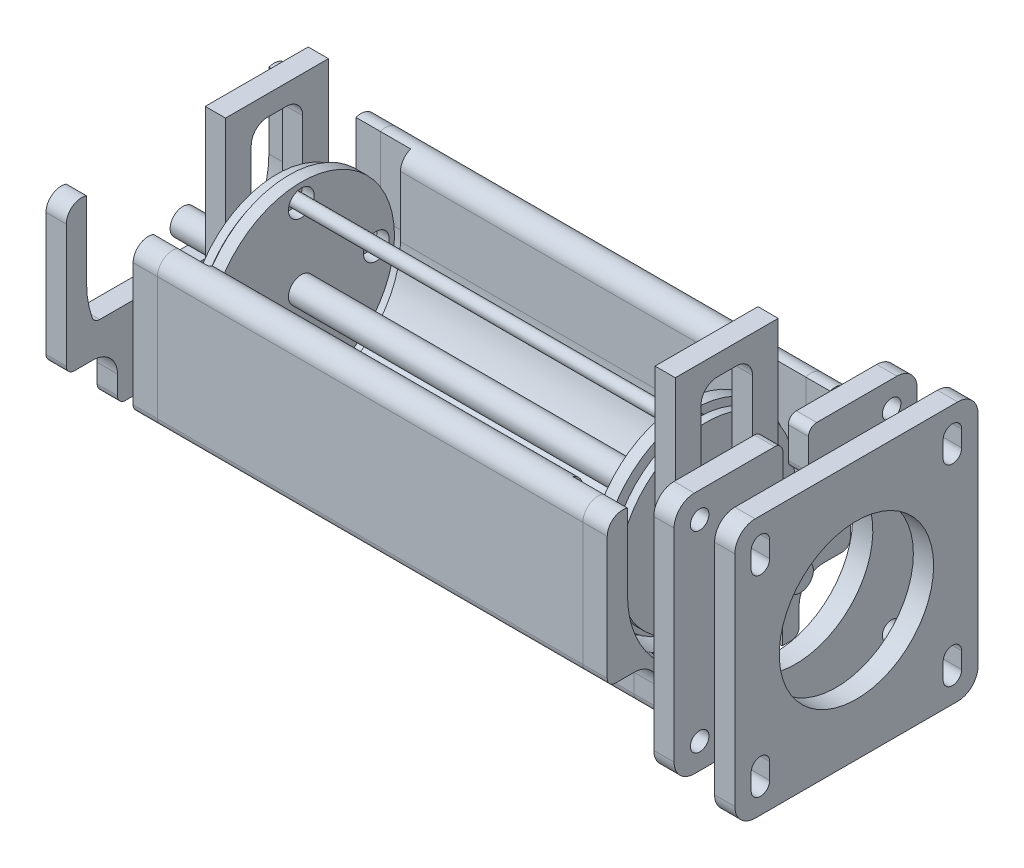
from build123d import *

# Parameters (mm, degrees)
SKETCH2_R                = 23
SKETCH2_R_2              = 3.175
BOSS_EXTRUDE2_DEPTH      = 3
BOSS_EXTRUDE3_DEPTH      = 90
FILLET1_R                = 2
SKETCH16_R               = 21.6875
SKETCH16_R_2             = 3.175
BOSS_EXTRUDE7_DEPTH      = 2
SKETCH21_R               = 1.5875
COMPRESSION_RODS_DEPTH   = 50.8
COMPRESSION_RODS_2_DEPTH = 50.8
COMPRESSION_RODS_3_DEPTH = 50.8
COMPRESSION_RODS_4_DEPTH = 50.8
BOSS_EXTRUDE13_DEPTH     = 7.5
FILLET4_R                = 2
SKETCH25_R               = 6.35
BOSS_EXTRUDE14_DEPTH     = 5
BOSS_EXTRUDE15_DEPTH     = 6
BOSS_EXTRUDE15_2_DEPTH   = 6
SKETCH27_R               = 2.286
BOSS_EXTRUDE17_DEPTH     = 5
FILLET7_R                = 2
FILLET8_R                = 2
SKETCH28_R               = 3.175
BOSS_EXTRUDE19_DEPTH     = 76.2
SKETCH30_R               = 19.05
BOSS_EXTRUDE21_DEPTH     = 5
BOSS_EXTRUDE22_DEPTH     = 5


with BuildPart() as part:
    # Sketch2 → Boss-Extrude2 (new body)
    with BuildSketch(Plane(origin=(-50, 0, 0), x_dir=(0, 0, -1), z_dir=(1, 0, 0))):
        Circle(SKETCH2_R)
        Circle(SKETCH2_R_2, mode=Mode.SUBTRACT)
        with Locations((0, 18.5125)):
            Circle(SKETCH2_R_2, mode=Mode.SUBTRACT)
        with Locations((-18.5125, 0)):
            Circle(SKETCH2_R_2, mode=Mode.SUBTRACT)
        with Locations((0, -18.5125)):
            Circle(SKETCH2_R_2, mode=Mode.SUBTRACT)
        with Locations((18.5125, 0)):
            Circle(SKETCH2_R_2, mode=Mode.SUBTRACT)
    extrude(amount=BOSS_EXTRUDE2_DEPTH)


with BuildPart() as body_2:
    # Sketch3 → Boss-Extrude3 (new body)
    with BuildSketch(Plane(origin=(45, 0, 0), x_dir=(0, 0, -1), z_dir=(1, 0, 0))):
        with BuildLine():
            Line((-22.48125, 0), (-22.48125, 15))
            ThreePointArc((-22.48125, 15), (-26.240625, 18.759375), (-30, 15))
            Line((-30, 15), (-30, -17.371))
            Line((-30, -17.371), (-23.371, -17.371))
            ThreePointArc((-23.371, -17.371), (-19.128359313, -19.128359313), (-17.371, -23.371))
            Line((-17.371, -23.371), (-17.371, -30))
            Line((-17.371, -30), (17.371, -30))
            Line((17.371, -30), (17.371, -23.371))
            ThreePointArc((17.371, -23.371), (19.128359313, -19.128359313), (23.371, -17.371))
            Line((23.371, -17.371), (30, -17.371))
            Line((30, -17.371), (30, 15))
            ThreePointArc((30, 15), (26.240625, 18.759375), (22.48125, 15))
            Line((22.48125, 15), (22.48125, 0))
            ThreePointArc((22.48125, 0), (0, -22.48125), (-22.48125, 0))
        make_face()
    extrude(amount=-BOSS_EXTRUDE3_DEPTH)

    # Fillet1
    fillet1_edges = [body_2.edges().sort_by_distance(p)[0] for p in [
        (0, -30, -17.371),
        (0, -30, 17.371),
        (0, -17.371, 30),
        (0, -17.371, -30),
    ]]
    fillet(fillet1_edges, radius=FILLET1_R)


with BuildPart() as body_3:
    # Sketch16 → Boss-Extrude7 (new body)
    with BuildSketch(Plane(origin=(-51, 0, 0), x_dir=(0, 0, -1), z_dir=(1, 0, 0))):
        Circle(SKETCH16_R)
        Circle(SKETCH16_R_2, mode=Mode.SUBTRACT)
    extrude(amount=-BOSS_EXTRUDE7_DEPTH)


with BuildPart() as body_4:
    # Sketch21 → Compression_Rods (new, symmetric)
    with BuildSketch(Plane(origin=(0, 0, 0), x_dir=(0, 0, -1), z_dir=(1, 0, 0))):
        with Locations((-18.5125, 0)):
            Circle(SKETCH21_R)
    extrude(amount=COMPRESSION_RODS_DEPTH, both=True)


with BuildPart() as body_5:
    # Sketch21 → Compression_Rods 2 (new, symmetric)
    with BuildSketch(Plane(origin=(0, 0, 0), x_dir=(0, 0, -1), z_dir=(1, 0, 0))):
        with Locations((0, 18.5125)):
            Circle(SKETCH21_R)
    extrude(amount=COMPRESSION_RODS_2_DEPTH, both=True)


with BuildPart() as body_6:
    # Sketch21 → Compression_Rods 3 (new, symmetric)
    with BuildSketch(Plane(origin=(0, 0, 0), x_dir=(0, 0, -1), z_dir=(1, 0, 0))):
        with Locations((18.5125, 0)):
            Circle(SKETCH21_R)
    extrude(amount=COMPRESSION_RODS_3_DEPTH, both=True)


with BuildPart() as body_7:
    # Sketch21 → Compression_Rods 4 (new, symmetric)
    with BuildSketch(Plane(origin=(0, 0, 0), x_dir=(0, 0, -1), z_dir=(1, 0, 0))):
        with Locations((0, -18.5125)):
            Circle(SKETCH21_R)
    extrude(amount=COMPRESSION_RODS_4_DEPTH, both=True)


with BuildPart() as body_8:
    # Mirror2: mirrored copy
    add(part.part.mirror(Plane(origin=(0, 0, 0), x_dir=(0, 0, 1), z_dir=(1, 0, 0))))


with BuildPart() as body_9:
    # Mirror2 2: mirrored copy
    add(body_3.part.mirror(Plane(origin=(0, 0, 0), x_dir=(0, 0, 1), z_dir=(1, 0, 0))))


with BuildPart() as body_10:
    # Sketch24 → Boss-Extrude13 (new body)
    with BuildSketch(Plane(origin=(45, 0, 0), x_dir=(0, 0, -1), z_dir=(1, 0, 0))):
        with BuildLine():
            Line((-25, 0), (-25, 18.548767392))
            ThreePointArc((-25, 18.548767392), (-28.416507095, 18.065687117), (-30, 15))
            Line((-30, 15), (-30, -17.371))
            Line((-30, -17.371), (-23.371, -17.371))
            ThreePointArc((-23.371, -17.371), (-19.128359313, -19.128359313), (-17.371, -23.371))
            Line((-17.371, -23.371), (-17.371, -30))
            Line((-17.371, -30), (17.371, -30))
            Line((17.371, -30), (17.371, -23.371))
            ThreePointArc((17.371, -23.371), (19.128359313, -19.128359313), (23.371, -17.371))
            Line((23.371, -17.371), (30, -17.371))
            Line((30, -17.371), (30, 15))
            ThreePointArc((30, 15), (28.416507095, 18.065687117), (25, 18.548767392))
            Line((25, 18.548767392), (25, 0))
            ThreePointArc((25, 0), (0, -25), (-25, 0))
        make_face()
    extrude(amount=BOSS_EXTRUDE13_DEPTH)

    # Fillet4
    fillet4_edges = [body_10.edges().sort_by_distance(p)[0] for p in [
        (48.75, -30, 17.371),
        (48.75, -17.371, 30),
        (48.75, -30, -17.371),
        (48.75, -17.371, -30),
    ]]
    fillet(fillet4_edges, radius=FILLET4_R)


with BuildPart() as body_11:
    # Sketch25 → Boss-Extrude14 (new body)
    with BuildSketch(Plane(origin=(53, 0, 0), x_dir=(0, 0, -1), z_dir=(1, 0, 0))):
        with BuildLine():
            ThreePointArc((-12.7, 0), (0, -12.7), (12.7, 0))
            Line((12.7, 0), (12.7, 40))
            Line((12.7, 40), (-12.7, 40))
            Line((-12.7, 40), (-12.7, 0))
        make_face()
        Circle(SKETCH25_R, mode=Mode.SUBTRACT)
        with BuildLine():
            Line((6.35, 31), (6.35, 12))
            ThreePointArc((6.35, 12), (5.178427125, 9.171572875), (2.35, 8))
            Line((2.35, 8), (-2.35, 8))
            ThreePointArc((-2.35, 8), (-5.178427125, 9.171572875), (-6.35, 12))
            Line((-6.35, 12), (-6.35, 31))
            ThreePointArc((-6.35, 31), (-5.178427125, 33.828427125), (-2.35, 35))
            Line((-2.35, 35), (2.35, 35))
            ThreePointArc((2.35, 35), (5.178427125, 33.828427125), (6.35, 31))
        make_face(mode=Mode.SUBTRACT)
    extrude(amount=BOSS_EXTRUDE14_DEPTH)


with BuildPart() as body_12:
    # Sketch26 → Boss-Extrude15 (new body)
    with BuildSketch(Plane(origin=(52.5, 0, 0), x_dir=(0, 0, -1), z_dir=(1, 0, 0))):
        with BuildLine():
            Line((-25, 0), (-25, 18.548767392))
            ThreePointArc((-25, 18.548767392), (-28.416507095, 18.065687117), (-30, 15))
            Line((-30, 15), (-30, -17.371))
            Line((-30, -17.371), (-23.371, -17.371))
            ThreePointArc((-23.371, -17.371), (-19.128359313, -19.128359313), (-17.371, -23.371))
            Line((-17.371, -23.371), (-17.371, -30))
            Line((-17.371, -30), (-13.2, -30))
            Line((-13.2, -30), (-13.2, -21.23110925))
            ThreePointArc((-13.2, -21.23110925), (-21.851773383, -12.144957801), (-25, 0))
        make_face()
    extrude(amount=BOSS_EXTRUDE15_DEPTH)

    # Fillet7
    fillet7_edges = [body_12.edges().sort_by_distance(p)[0] for p in [
        (55.5, -30, 17.371),
        (55.5, -17.371, 30),
    ]]
    fillet(fillet7_edges, radius=FILLET7_R)


with BuildPart() as body_13:
    # Sketch26 → Boss-Extrude15 2 (new body)
    with BuildSketch(Plane(origin=(52.5, 0, 0), x_dir=(0, 0, -1), z_dir=(1, 0, 0))):
        with BuildLine():
            Line((13.2, -30), (13.2, -21.23110925))
            ThreePointArc((13.2, -21.23110925), (21.851773383, -12.144957801), (25, 0))
            Line((25, 0), (25, 18.548767392))
            ThreePointArc((25, 18.548767392), (28.416507095, 18.065687117), (30, 15))
            Line((30, 15), (30, -17.371))
            Line((30, -17.371), (23.371, -17.371))
            ThreePointArc((23.371, -17.371), (19.128359313, -19.128359313), (17.371, -23.371))
            Line((17.371, -23.371), (17.371, -30))
            Line((17.371, -30), (13.2, -30))
        make_face()
    extrude(amount=BOSS_EXTRUDE15_2_DEPTH)

    # Fillet8
    fillet8_edges = [body_13.edges().sort_by_distance(p)[0] for p in [
        (55.5, -30, -17.371),
        (55.5, -17.371, -30),
    ]]
    fillet(fillet8_edges, radius=FILLET8_R)


with BuildPart() as body_14:
    # Sketch27 → Boss-Extrude17 (new body)
    with BuildSketch(Plane(origin=(70, 0, 0), x_dir=(0, 0, -1), z_dir=(1, 0, 0))):
        with BuildLine():
            Line((-5.175, 30), (-25, 30))
            ThreePointArc((-25, 30), (-28.535533906, 28.535533906), (-30, 25))
            Line((-30, 25), (-30, -25))
            ThreePointArc((-30, -25), (-28.535533906, -28.535533906), (-25, -30))
            Line((-25, -30), (25, -30))
            ThreePointArc((25, -30), (28.535533906, -28.535533906), (30, -25))
            Line((30, -25), (30, 25))
            ThreePointArc((30, 25), (28.535533906, 28.535533906), (25, 30))
            Line((25, 30), (5.175, 30))
            ThreePointArc((5.175, 30), (3.760786438, 29.414213562), (3.175, 28))
            Line((3.175, 28), (3.175, 20.403967139))
            ThreePointArc((3.175, 20.403967139), (3.596492331, 19.175832969), (4.683313539, 18.465347933))
            ThreePointArc((4.683313539, 18.465347933), (15.035285546, 11.697977968), (19.05, 0))
            ThreePointArc((19.05, 0), (0, -19.05), (-19.05, 0))
            ThreePointArc((-19.05, 0), (-15.035285546, 11.697977968), (-4.683313539, 18.465347933))
            ThreePointArc((-4.683313539, 18.465347933), (-3.596492331, 19.175832969), (-3.175, 20.403967139))
            Line((-3.175, 20.403967139), (-3.175, 28))
            ThreePointArc((-3.175, 28), (-3.760786438, 29.414213562), (-5.175, 30))
        make_face()
        with Locations((-23.6855, 23.6855)):
            Circle(SKETCH27_R, mode=Mode.SUBTRACT)
        with Locations((23.6855, 23.6855)):
            Circle(SKETCH27_R, mode=Mode.SUBTRACT)
        with Locations((-23.6855, -23.6855)):
            Circle(SKETCH27_R, mode=Mode.SUBTRACT)
        with Locations((23.6855, -23.6855)):
            Circle(SKETCH27_R, mode=Mode.SUBTRACT)
    extrude(amount=BOSS_EXTRUDE17_DEPTH)


with BuildPart() as body_15:
    # Mirror5: mirrored copy
    add(body_10.part.mirror(Plane(origin=(0, 0, 0), x_dir=(0, 0, 1), z_dir=(1, 0, 0))))


with BuildPart() as body_16:
    # Mirror6: mirrored copy
    add(body_12.part.mirror(Plane(origin=(0, 0, 0), x_dir=(0, 0, 1), z_dir=(1, 0, 0))))


with BuildPart() as body_17:
    # Mirror6 2: mirrored copy
    add(body_13.part.mirror(Plane(origin=(0, 0, 0), x_dir=(0, 0, 1), z_dir=(1, 0, 0))))


with BuildPart() as body_18:
    # Mirror8: mirrored copy
    add(body_11.part.mirror(Plane(origin=(0, 0, 0), x_dir=(0, 0, 1), z_dir=(1, 0, 0))))


with BuildPart() as part_1:
    add(part.part)

    add(body_3.part)  # Boss-Extrude19 merges body 3

    add(body_8.part)  # Boss-Extrude19 merges body 8

    add(body_9.part)  # Boss-Extrude19 merges body 9

    add(body_11.part)  # Boss-Extrude19 merges body 11

    add(body_18.part)  # Boss-Extrude19 merges body 18

    add(body_2.part)  # Boss-Extrude19 merges body 2

    add(body_10.part)  # Boss-Extrude19 merges body 10

    add(body_15.part)  # Boss-Extrude19 merges body 15
    # Sketch28 → Boss-Extrude19 (add, symmetric)
    with BuildSketch(Plane(origin=(0, 0, 0), x_dir=(0, 0, -1), z_dir=(1, 0, 0))):
        Circle(SKETCH28_R)
    extrude(amount=BOSS_EXTRUDE19_DEPTH, both=True)


with BuildPart() as body_11_2:
    # Sketch30 → Boss-Extrude21 (new body)
    with BuildSketch(Plane(origin=(85, 0, 0), x_dir=(0, 0, -1), z_dir=(1, 0, 0))):
        with BuildLine():
            Line((-25, 32), (25, 32))
            ThreePointArc((25, 32), (28.535533906, 30.535533906), (30, 27))
            Line((30, 27), (30, -27))
            ThreePointArc((30, -27), (28.535533906, -30.535533906), (25, -32))
            Line((25, -32), (-25, -32))
            ThreePointArc((-25, -32), (-28.535533906, -30.535533906), (-30, -27))
            Line((-30, -27), (-30, 27))
            ThreePointArc((-30, 27), (-28.535533906, 30.535533906), (-25, 32))
        make_face()
        Circle(SKETCH30_R, mode=Mode.SUBTRACT)
        with BuildLine():
            Line((-25.9715, 25.6855), (-25.9715, 21.6855))
            ThreePointArc((-25.9715, 21.6855), (-23.6855, 19.3995), (-21.3995, 21.6855))
            Line((-21.3995, 21.6855), (-21.3995, 25.6855))
            ThreePointArc((-21.3995, 25.6855), (-23.6855, 27.9715), (-25.9715, 25.6855))
        make_face(mode=Mode.SUBTRACT)
        with BuildLine():
            Line((21.3995, 25.6855), (21.3995, 21.6855))
            ThreePointArc((21.3995, 21.6855), (23.6855, 19.3995), (25.9715, 21.6855))
            Line((25.9715, 21.6855), (25.9715, 25.6855))
            ThreePointArc((25.9715, 25.6855), (23.6855, 27.9715), (21.3995, 25.6855))
        make_face(mode=Mode.SUBTRACT)
        with BuildLine():
            Line((25.9715, -25.6855), (25.9715, -21.6855))
            ThreePointArc((25.9715, -21.6855), (23.6855, -19.3995), (21.3995, -21.6855))
            Line((21.3995, -21.6855), (21.3995, -25.6855))
            ThreePointArc((21.3995, -25.6855), (23.6855, -27.9715), (25.9715, -25.6855))
        make_face(mode=Mode.SUBTRACT)
        with BuildLine():
            Line((-21.3995, -25.6855), (-21.3995, -21.6855))
            ThreePointArc((-21.3995, -21.6855), (-23.6855, -19.3995), (-25.9715, -21.6855))
            Line((-25.9715, -21.6855), (-25.9715, -25.6855))
            ThreePointArc((-25.9715, -25.6855), (-23.6855, -27.9715), (-21.3995, -25.6855))
        make_face(mode=Mode.SUBTRACT)
    extrude(amount=BOSS_EXTRUDE21_DEPTH)


with BuildPart() as body_12_2:
    # Sketch34 → Boss-Extrude22 (new body)
    with BuildSketch(Plane(origin=(-75, 0, 0), x_dir=(0, 0, -1), z_dir=(1, 0, 0))):
        with BuildLine():
            Line((-25, 0), (-25, 18.548767392))
            ThreePointArc((-25, 18.548767392), (-28.416507095, 18.065687117), (-30, 15))
            Line((-30, 15), (-30, -15.371))
            ThreePointArc((-30, -15.371), (-29.414213562, -16.785213562), (-28, -17.371))
            Line((-28, -17.371), (-23.371, -17.371))
            ThreePointArc((-23.371, -17.371), (-19.128359313, -19.128359313), (-17.371, -23.371))
            Line((-17.371, -23.371), (-17.371, -28))
            ThreePointArc((-17.371, -28), (-16.785213562, -29.414213562), (-15.371, -30))
            Line((-15.371, -30), (15.371, -30))
            ThreePointArc((15.371, -30), (16.785213562, -29.414213562), (17.371, -28))
            Line((17.371, -28), (17.371, -23.371))
            ThreePointArc((17.371, -23.371), (19.128359313, -19.128359313), (23.371, -17.371))
            Line((23.371, -17.371), (28, -17.371))
            ThreePointArc((28, -17.371), (29.414213562, -16.785213562), (30, -15.371))
            Line((30, -15.371), (30, 15))
            ThreePointArc((30, 15), (28.416507095, 18.065687117), (25, 18.548767392))
            Line((25, 18.548767392), (25, 0))
            ThreePointArc((25, 0), (24.653626397, -4.147132198), (23.624103563, -8.179347826))
            ThreePointArc((23.624103563, -8.179347826), (22.894197766, -9.154216936), (21.734175278, -9.525))
            Line((21.734175278, -9.525), (-21.734175278, -9.525))
            ThreePointArc((-21.734175278, -9.525), (-22.894197766, -9.154216936), (-23.624103563, -8.179347826))
            ThreePointArc((-23.624103563, -8.179347826), (-24.653626397, -4.147132198), (-25, 0))
        make_face()
    extrude(amount=-BOSS_EXTRUDE22_DEPTH)


solid = Compound([body_4.part, body_5.part, body_6.part, body_7.part, body_12.part, body_13.part, body_14.part, body_16.part, body_17.part, part_1.part, body_11_2.part, body_12_2.part])
